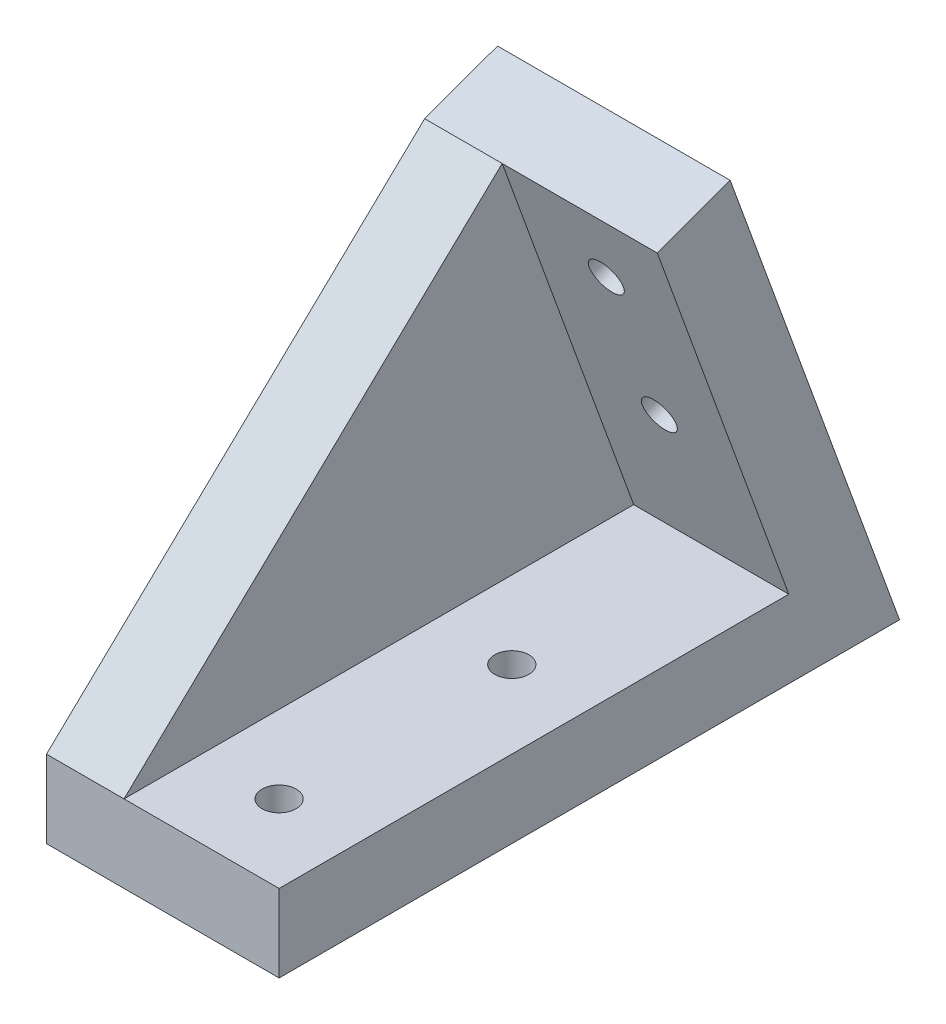
from build123d import *

# Parameters (mm, degrees)
SKETCH1_W           = 15
SKETCH1_H           = 30
BOSS_EXTRUDE1_DEPTH = 40
CUT_EXTRUDE1_DEPTH  = 40
BOSS_EXTRUDE2_DEPTH = 10
CUT_EXTRUDE2_DEPTH  = 10
CUT_EXTRUDE3_DEPTH  = 10
SKETCH7_R           = 1.1
CUT_EXTRUDE4_DEPTH  = 10
SKETCH8_R           = 1.1
CUT_EXTRUDE5_DEPTH  = 10


with BuildPart() as part:
    # Sketch1 → Boss-Extrude1 (new body)
    with BuildSketch(Plane.XY):
        with Locations((7.5, 15)):
            Rectangle(SKETCH1_W, SKETCH1_H)
    extrude(amount=BOSS_EXTRUDE1_DEPTH)

    # Sketch2 → Cut-Extrude1 (cut)
    with BuildSketch(Plane(origin=(15, 0, 0), x_dir=(0, 0, -1), z_dir=(1, 0, 0))):
        Polygon((0, 0), (-10.919107028, 30), (0, 30), align=None)
    extrude(amount=-CUT_EXTRUDE1_DEPTH, mode=Mode.SUBTRACT)

    # Sketch3 → Boss-Extrude2 (add)
    with BuildSketch(Plane(origin=(15, 0, 0), x_dir=(0, 0, -1), z_dir=(1, 0, 0))):
        Polygon((-10.919107028, 30), (-15.617570132, 28.289899283), (-7.140740034, 5), (-40, 5), (-40, 0), (0, 0), align=None)
    extrude(amount=BOSS_EXTRUDE2_DEPTH)

    # Sketch5 → Cut-Extrude2 (cut)
    with BuildSketch(Plane.ZY):
        Polygon((10.919107028, 30), (40, 30), (40, 0), (0, 0), align=None)
    extrude(amount=-CUT_EXTRUDE2_DEPTH, mode=Mode.SUBTRACT)

    # Sketch6 → Cut-Extrude3 (cut)
    with BuildSketch(Plane(origin=(15, 0, 0), x_dir=(0, 0, -1), z_dir=(1, 0, 0))):
        Polygon((-15.617570132, 28.289899283), (-40, 5), (-40, 30), (-10.919107028, 30), align=None)
    extrude(amount=-CUT_EXTRUDE3_DEPTH, mode=Mode.SUBTRACT)

    # Sketch7 → Cut-Extrude4 (cut)
    with BuildSketch(Plane.XZ):
        with Locations(Location((20, 35, 0), (0, 0, 270))):
            Circle(SKETCH7_R)
        with Locations(Location((20, 20, 0), (0, 0, 270))):
            Circle(SKETCH7_R)
    extrude(amount=-CUT_EXTRUDE4_DEPTH, mode=Mode.SUBTRACT)

    # Sketch8 → Cut-Extrude5 (cut)
    with BuildSketch(Plane(origin=(0, 0, 0), x_dir=(-1, 0, 0), z_dir=(0, 0.342020143325663, -0.9396926207859105))):
        with Locations(Location((-20, 26.925333174, 0), (0, 0, 90))):
            Circle(SKETCH8_R)
        with Locations(Location((-20, 16.925333174, 0), (0, 0, 90))):
            Circle(SKETCH8_R)
    extrude(amount=-CUT_EXTRUDE5_DEPTH, mode=Mode.SUBTRACT)


solid = part.part
